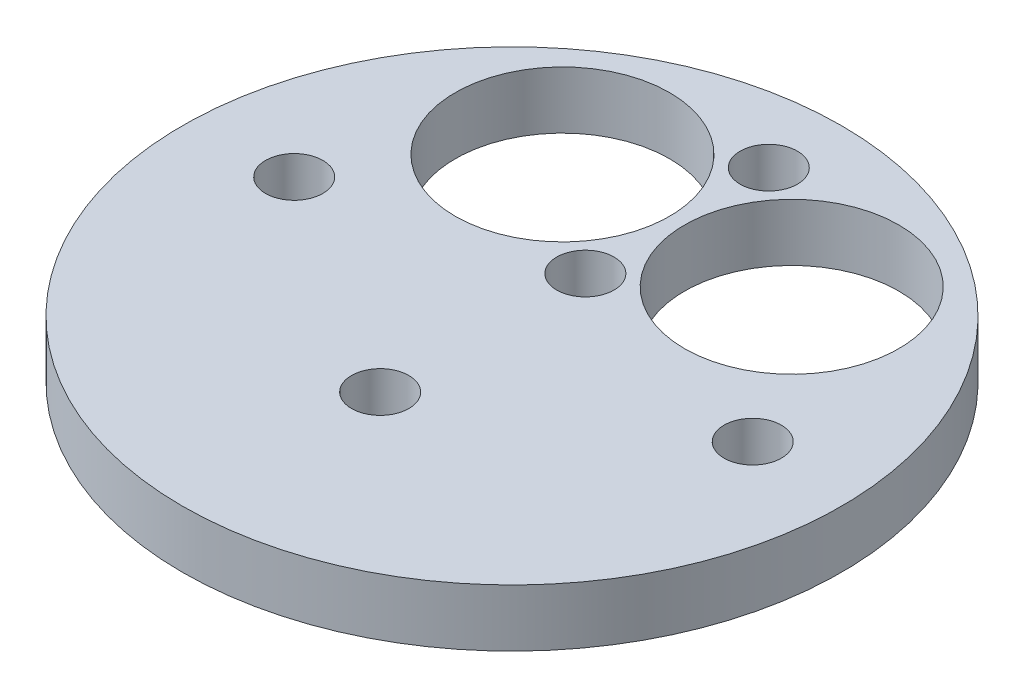
from build123d import *

# Parameters (mm, degrees)
SKETCH1_W               = 36.5125
SKETCH1_H               = 6.35
CUT_EXTRUDE1_DEPTH      = 53.025453506
CUT_EXTRUDE1_DEPTH_BACK = 53.025453506
SKETCH2_R               = 11.8745
SKETCH2_R_2             = 3.175
CUT_EXTRUDE2_DEPTH      = 53.025453506
CUT_EXTRUDE2_DEPTH_BACK = 53.025453506
SKETCH3_R               = 3.175


with BuildPart() as part:
    # Sketch1 → Revolve1 (revolve)
    with BuildSketch(Plane.XY):
        with Locations((18.25625, 3.175)):
            Rectangle(SKETCH1_W, SKETCH1_H)
    revolve(axis=Axis((0, 0, 0), (0, 1, 0)))

    # Sketch2 → Cut-Extrude1 (cut, two sides: drawn at the far end of the back side and taken through both)
    with BuildSketch(Plane(origin=(0, 6.35, 0), x_dir=(1, 0, 0), z_dir=(0, 1, 0)).offset(-CUT_EXTRUDE1_DEPTH_BACK)):
        with Locations((-12.7, 18.288)):
            Circle(SKETCH2_R)
        with Locations((12.7, 18.288)):
            Circle(SKETCH2_R)
        with Locations((0, 28.448)):
            Circle(SKETCH2_R_2)
        with Locations((0, 8.128)):
            Circle(SKETCH2_R_2)
        with Locations((0, -14.605)):
            Circle(SKETCH2_R_2)
    extrude(amount=CUT_EXTRUDE1_DEPTH + CUT_EXTRUDE1_DEPTH_BACK, mode=Mode.SUBTRACT)

    # Sketch3 → Cut-Extrude2 (cut, two sides: drawn at the far end of the back side and taken through both)
    with BuildSketch(Plane(origin=(0, 6.35, 0), x_dir=(1, 0, 0), z_dir=(0, 1, 0)).offset(-CUT_EXTRUDE2_DEPTH_BACK)):
        with Locations((-25.4, 1.27)):
            Circle(SKETCH3_R)
        with Locations((25.4, 1.27)):
            Circle(SKETCH3_R)
    extrude(amount=CUT_EXTRUDE2_DEPTH + CUT_EXTRUDE2_DEPTH_BACK, mode=Mode.SUBTRACT)


solid = part.part
